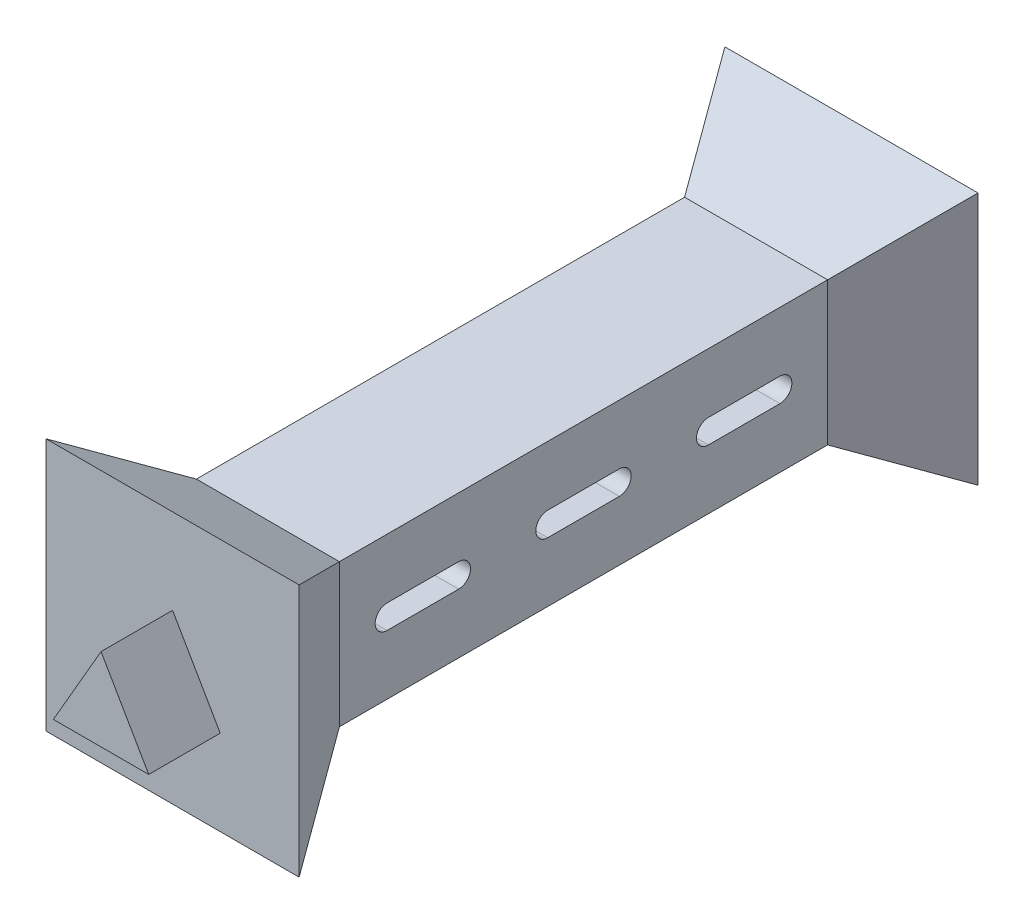
from build123d import *

# Parameters (mm, degrees)
SKETCH1_W               = 3
SKETCH1_H               = 3
BOSS_EXTRUDE1_DEPTH     = 10.24
SKETCH2_W               = 3
SKETCH2_H               = 3
BOSS_EXTRUDE2_DEPTH     = 2
BOSS_EXTRUDE2_DRAFT     = -30
MIRROR1_COPY_1_SKETCH_W = 3
MIRROR1_COPY_1_SKETCH_H = 3
MIRROR1_COPY_1_DEPTH    = 2
MIRROR1_COPY_1_DRAFT    = -30
BOSS_EXTRUDE3_DEPTH     = 1.5
CUT_EXTRUDE1_REACH      = 16.598


with BuildPart() as part:
    # Sketch1 → Boss-Extrude1 (new body)
    with BuildSketch(Plane.XY):
        Rectangle(SKETCH1_W, SKETCH1_H)
    extrude(amount=BOSS_EXTRUDE1_DEPTH)


with BuildPart() as boss_extrude2_tool:
    # Sketch2 → Boss-Extrude2 (with draft: the straight prism first)
    with BuildSketch(Plane.XY.offset(10.24)):
        Rectangle(SKETCH2_W, SKETCH2_H)
    extrude(amount=BOSS_EXTRUDE2_DEPTH)
    # Boss-Extrude2: the draft: its side faces are tilted about the plane it starts from
    boss_extrude2_sides = [boss_extrude2_tool.faces().sort_by_distance(p)[0] for p in [
        (1.5, 0, 11.24),
        (0, 1.5, 11.24),
        (-1.5, 0, 11.24),
        (0, -1.5, 11.24),
    ]]
    draft(boss_extrude2_sides, Plane.XY.offset(10.24), BOSS_EXTRUDE2_DRAFT)


with BuildPart() as part_1:
    add(part.part)

    # Boss-Extrude2: add boss_extrude2_tool
    add(boss_extrude2_tool.part)


with BuildPart() as mirror1_copy_1_tool:
    # Mirror1 copy 1 sketch → Mirror1 copy 1 (with draft: the straight prism first)
    with BuildSketch(Plane(origin=(0, 0, 0), x_dir=(1, 0, 0), z_dir=(0, 0, -1))):
        Rectangle(MIRROR1_COPY_1_SKETCH_W, MIRROR1_COPY_1_SKETCH_H)
    extrude(amount=MIRROR1_COPY_1_DEPTH)
    # Mirror1 copy 1: the draft: its side faces are tilted about the plane it starts from
    mirror1_copy_1_sides = [mirror1_copy_1_tool.faces().sort_by_distance(p)[0] for p in [
        (1.5, 0, -1),
        (0, 1.5, -1),
        (-1.5, 0, -1),
        (0, -1.5, -1),
    ]]
    draft(mirror1_copy_1_sides, Plane(origin=(0, 0, 0), x_dir=(1, 0, 0), z_dir=(0, 0, -1)), MIRROR1_COPY_1_DRAFT)


with BuildPart() as part_2:
    add(part_1.part)

    # Mirror1 copy 1: add mirror1_copy_1_tool
    add(mirror1_copy_1_tool.part)

    # Sketch3 → Boss-Extrude3 (add)
    with BuildSketch(Plane.XY.offset(12.24)):
        Polygon((0, 0.866025404), (-1, -0.866025404), (1, -0.866025404), align=None)
    boss_extrude3 = extrude(amount=BOSS_EXTRUDE3_DEPTH)

    # Mirror2: Boss-Extrude3 across plane
    add(boss_extrude3.mirror(Plane.XY.offset(5.12)))

    # Sketch7 → Cut-Extrude1 (cut, up to next)
    with BuildSketch(Plane(origin=(1.5, 0, 0), x_dir=(0, 0, -1), z_dir=(1, 0, 0)), mode=Mode.PRIVATE) as cut_extrude1_sk1:
        with BuildLine():
            Line((-9.24, 0.25), (-7.74, 0.25))
            ThreePointArc((-7.74, 0.25), (-7.49, 0), (-7.74, -0.25))
            Line((-7.74, -0.25), (-9.24, -0.25))
            ThreePointArc((-9.24, -0.25), (-9.49, 0), (-9.24, 0.25))
        make_face()
    cut_extrude1_tool1 = extrude(cut_extrude1_sk1.sketch, amount=-CUT_EXTRUDE1_REACH, mode=Mode.PRIVATE) & part_2.part
    # Sketch7 → Cut-Extrude1 (cut, up to next)
    with BuildSketch(Plane(origin=(1.5, 0, 0), x_dir=(0, 0, -1), z_dir=(1, 0, 0)), mode=Mode.PRIVATE) as cut_extrude1_sk2:
        with BuildLine():
            Line((-5.87, 0.25), (-4.37, 0.25))
            ThreePointArc((-4.37, 0.25), (-4.12, 0), (-4.37, -0.25))
            Line((-4.37, -0.25), (-5.87, -0.25))
            ThreePointArc((-5.87, -0.25), (-6.12, 0), (-5.87, 0.25))
        make_face()
    cut_extrude1_tool2 = extrude(cut_extrude1_sk2.sketch, amount=-CUT_EXTRUDE1_REACH, mode=Mode.PRIVATE) & part_2.part
    # Sketch7 → Cut-Extrude1 (cut, up to next)
    with BuildSketch(Plane(origin=(1.5, 0, 0), x_dir=(0, 0, -1), z_dir=(1, 0, 0)), mode=Mode.PRIVATE) as cut_extrude1_sk3:
        with BuildLine():
            Line((-2.5, 0.25), (-1, 0.25))
            ThreePointArc((-1, 0.25), (-0.75, 0), (-1, -0.25))
            Line((-1, -0.25), (-2.5, -0.25))
            ThreePointArc((-2.5, -0.25), (-2.75, 0), (-2.5, 0.25))
        make_face()
    cut_extrude1_tool3 = extrude(cut_extrude1_sk3.sketch, amount=-CUT_EXTRUDE1_REACH, mode=Mode.PRIVATE) & part_2.part
    add(cut_extrude1_tool1.solids().sort_by_distance((1.5, 0, 8.49))[0], mode=Mode.SUBTRACT)
    add(cut_extrude1_tool2.solids().sort_by_distance((1.5, 0, 5.12))[0], mode=Mode.SUBTRACT)
    add(cut_extrude1_tool3.solids().sort_by_distance((1.5, 0, 1.75))[0], mode=Mode.SUBTRACT)


solid = part_2.part
